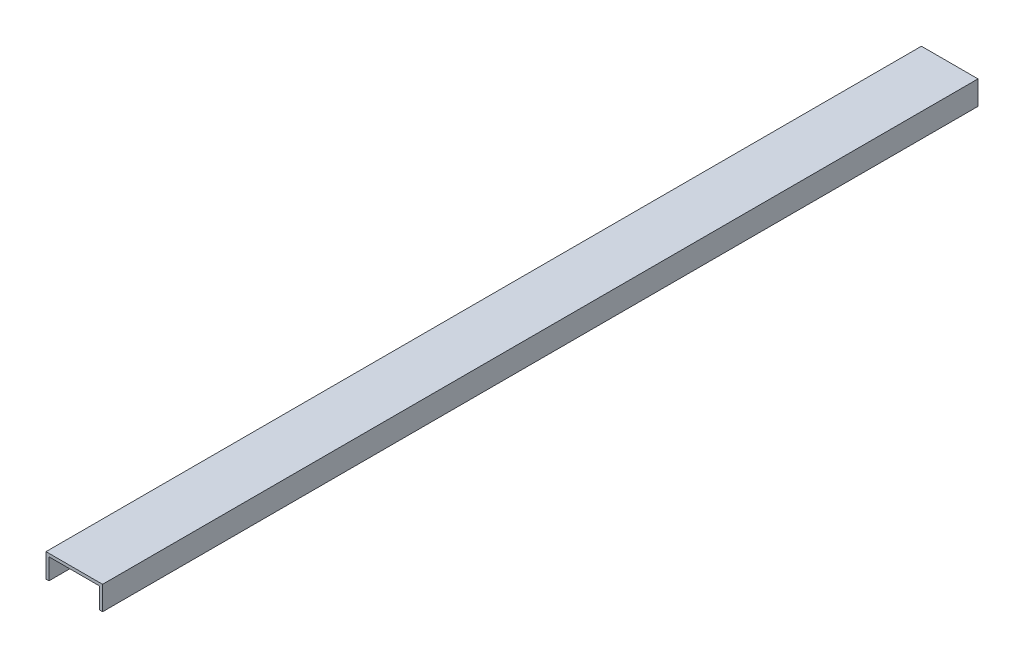
from build123d import *

# Parameters (mm, degrees)
BOSS_EXTRUDE1_DEPTH = 294


with BuildPart() as part:
    # Sketch1 → Boss-Extrude1 (new body)
    with BuildSketch(Plane.XY):
        Polygon((0, 0), (-8.5, 0), (-8.5, -7), (-9.5, -7), (-9.5, 1), (9.5, 1), (9.5, -7), (8.5, -7), (8.5, 0), align=None)
    extrude(amount=BOSS_EXTRUDE1_DEPTH)


solid = part.part
